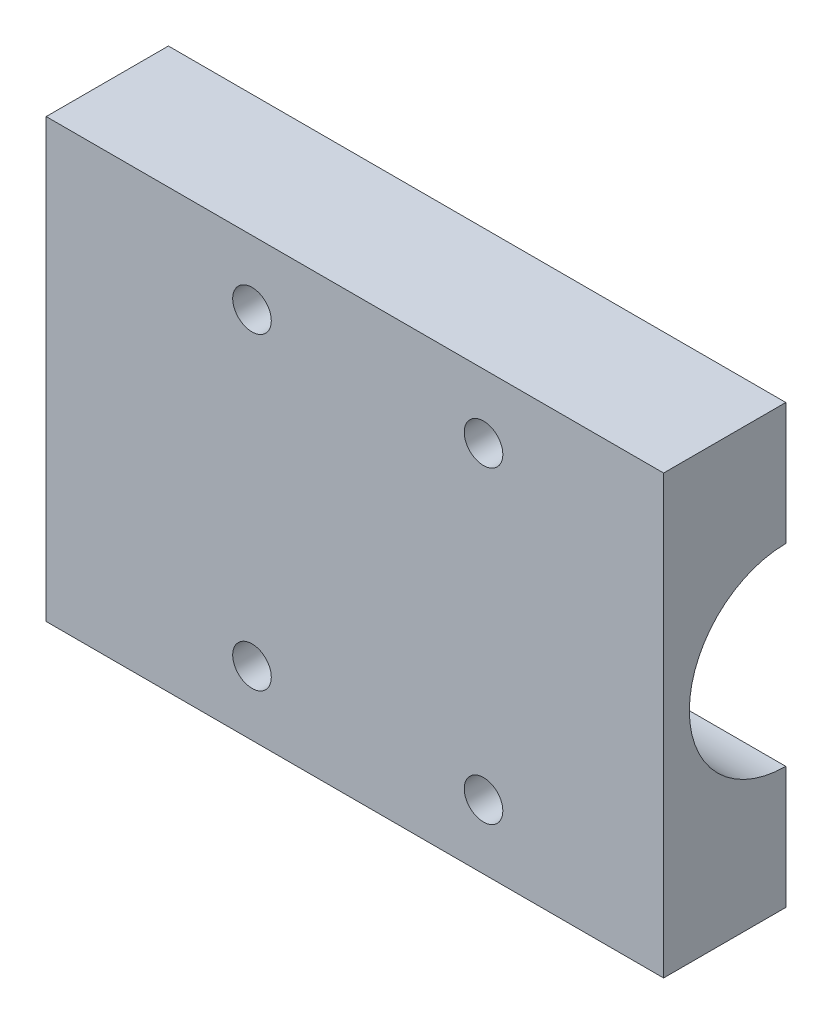
from build123d import *

# Parameters (mm, degrees)
SKETCH_1_W          = 48
SKETCH_1_H          = 34
SKETCH_1_R          = 1.5
EXTRUDE_1_DEPTH     = 9.5
SKETCH_2_R          = 7.5
CUT_EXTRUDE_1_DEPTH = 49.5


with BuildPart() as part:
    # 草图1 → 凸台-拉伸1 (new body)
    with BuildSketch(Plane.XY):
        with Locations((11.664804469, -2.586592179)):
            Rectangle(SKETCH_1_W, SKETCH_1_H)
        with Locations((3.664804469, 9.413407821)):
            Circle(SKETCH_1_R, mode=Mode.SUBTRACT)
        with Locations((3.664804469, -14.586592179)):
            Circle(SKETCH_1_R, mode=Mode.SUBTRACT)
        with Locations((21.664804469, 9.413407821)):
            Circle(SKETCH_1_R, mode=Mode.SUBTRACT)
        with Locations((21.664804469, -14.586592179)):
            Circle(SKETCH_1_R, mode=Mode.SUBTRACT)
    extrude(amount=EXTRUDE_1_DEPTH)

    # 草图2 → 切除-拉伸1 (cut)
    with BuildSketch(Plane.ZY.offset(12.335195531)):
        with Locations((0, -2.586592179)):
            Circle(SKETCH_2_R)
    extrude(amount=-CUT_EXTRUDE_1_DEPTH, mode=Mode.SUBTRACT)


solid = part.part
